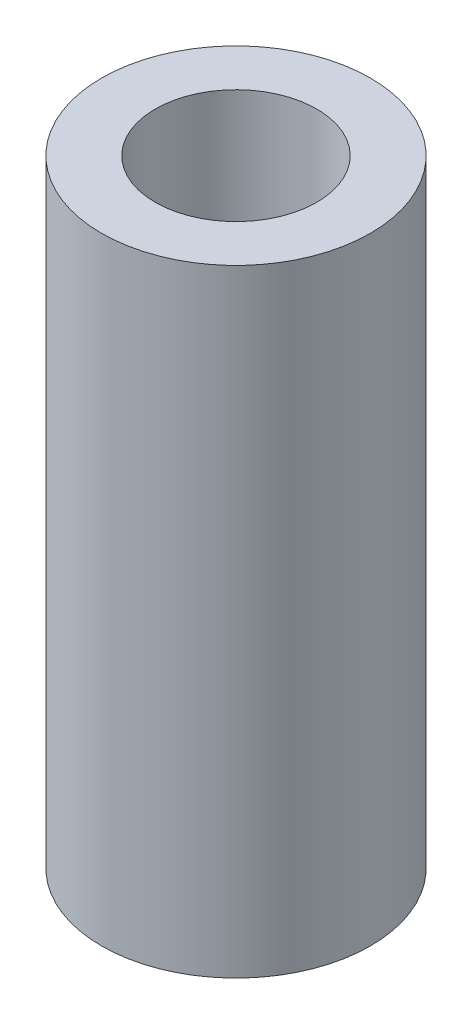
from build123d import *

# Parameters (mm, degrees)
SKETCH1_R           = 3.9624
SKETCH1_R_2         = 2.38125
BOSS_EXTRUDE1_DEPTH = 9.094875003


with BuildPart() as part:
    # Sketch1 → Boss-Extrude1 (new, symmetric)
    with BuildSketch(Plane(origin=(0, 0, 0), x_dir=(1, 0, 0), z_dir=(0, 1, 0))):
        with Locations(Location((0, 0, 0), (0, 0, 270))):
            Circle(SKETCH1_R)
        with Locations(Location((0, 0, 0), (0, 0, 270))):
            Circle(SKETCH1_R_2, mode=Mode.SUBTRACT)
    extrude(amount=BOSS_EXTRUDE1_DEPTH, both=True)


solid = part.part
